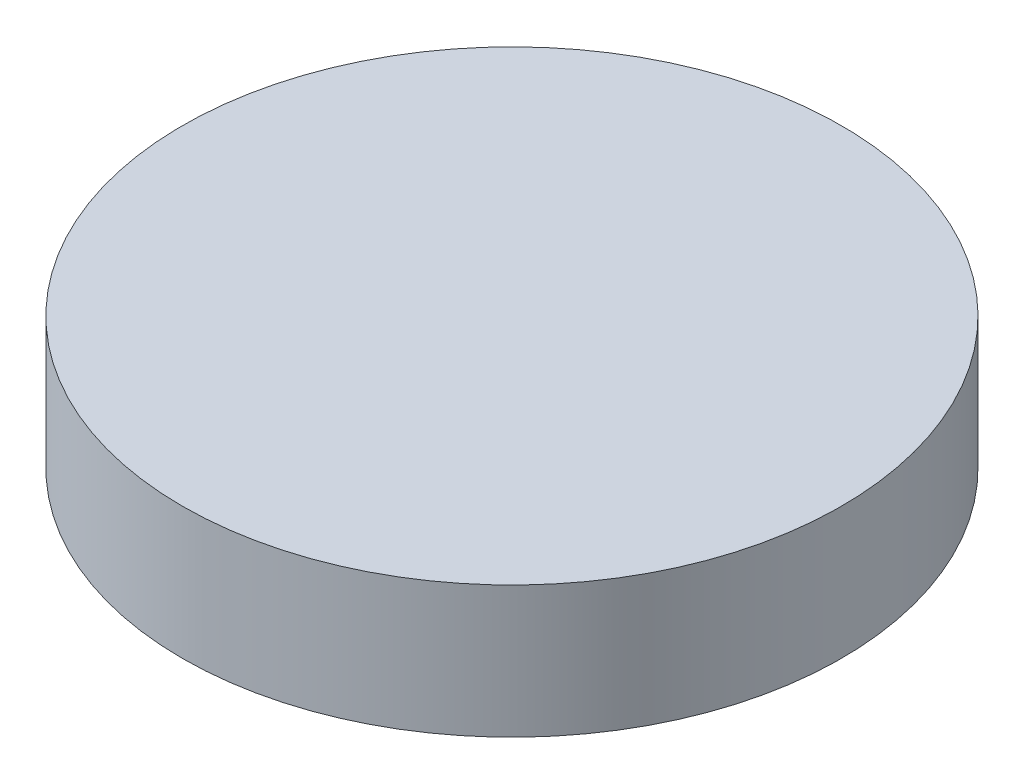
from build123d import *

# Parameters (mm, degrees)
SKETCH_1_R      = 20
EXTRUDE_1_DEPTH = 8


with BuildPart() as part:
    # 草图1 → 凸台-拉伸1 (new body)
    with BuildSketch(Plane(origin=(0, 0, 0), x_dir=(1, 0, 0), z_dir=(0, 1, 0))):
        with Locations(Location((0, 0, 0), (0, 0, 270))):
            Circle(SKETCH_1_R)
    extrude(amount=EXTRUDE_1_DEPTH)


solid = part.part
